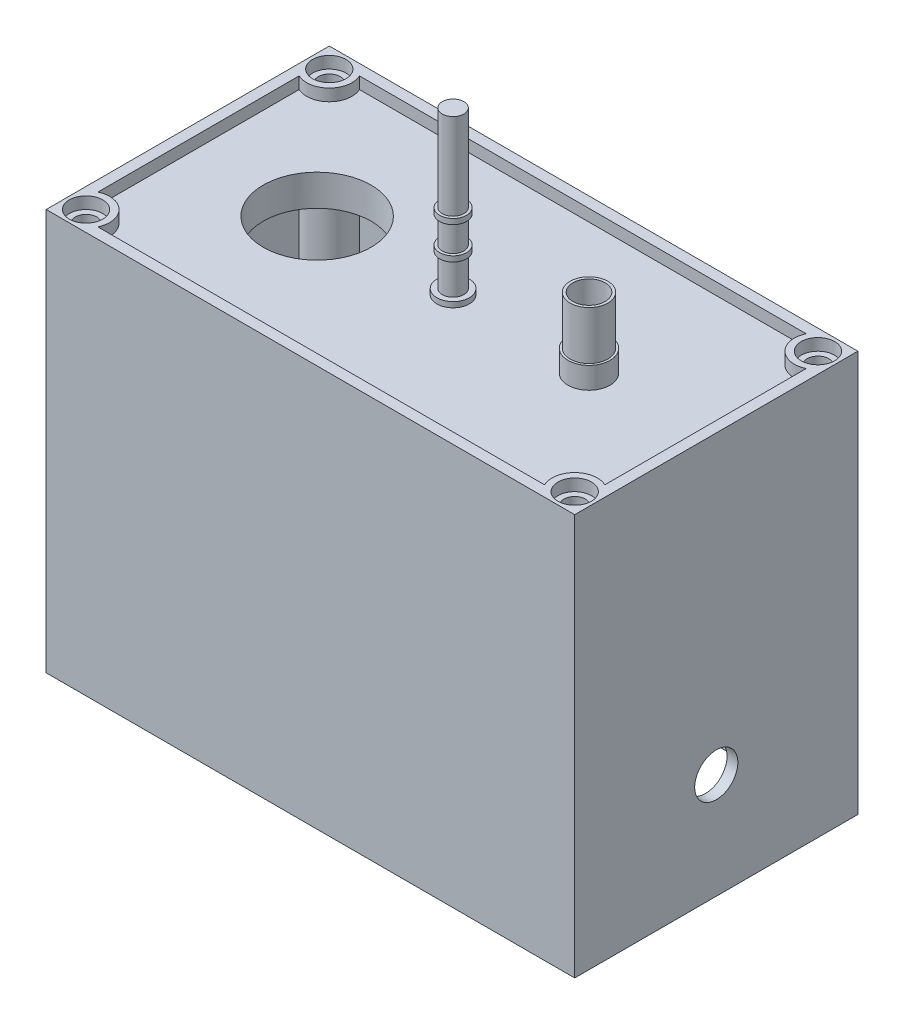
from build123d import *

# Parameters (mm, degrees)
SKETCH_1_W               = 49
SKETCH_1_H               = 26.25
EXTRUDE_1_DEPTH          = 5
SKETCH_2_R               = 1.55
CUT_EXTRUDE_1_DEPTH      = 1.1
MIRROR_2_COPY_1_SKETCH_R = 1.55
MIRROR_2_COPY_1_DEPTH    = 1.1
CUT_EXTRUDE_2_DEPTH      = 1.1
SKETCH_4_R               = 1
CUT_EXTRUDE_3_DEPTH      = 50
SKETCH_5_R               = 5
CUT_EXTRUDE_4_DEPTH      = 29.066450167
SKETCH_6_R               = 1.5
SKETCH_6_R_2             = 1
EXTRUDE_2_DEPTH          = 0.5
CUT_EXTRUDE_START        = -1
CUT_EXTRUDE_6_DEPTH      = 1
SKETCH_23_R              = 1.5
CUT_EXTRUDE_14_DEPTH     = 29.066450167
EXTRUDE_START            = 6.5
SKETCH_25_R              = 1.75
SKETCH_25_R_2            = 1.5
EXTRUDE_13_DEPTH         = 6.5
SKETCH_26_R              = 1
EXTRUDE_14_DEPTH         = 15
SKETCH_20_R              = 1.25
SKETCH_20_R_2            = 1
EXTRUDE_10_DEPTH         = 0.5
SKETCH_27_R              = 1.25
SKETCH_27_R_2            = 1
EXTRUDE_15_DEPTH         = 0.5
EXTRUDE_START_2          = 2
SKETCH_28_R              = 1.95
SKETCH_28_R_2            = 1.75
EXTRUDE_16_DEPTH         = 2
SKETCH_30_W              = 49
SKETCH_30_H              = 26.25
EXTRUDE_17_DEPTH         = 32.2
SKETCH_31_R              = 1
CUT_EXTRUDE_15_DEPTH     = 43.536521073
CUT_EXTRUDE_16_REACH     = 62.084
SKETCH_32_R              = 2


with BuildPart() as part:
    # 草图1 → 凸台-拉伸1 (new body)
    with BuildSketch(Plane(origin=(0, 0, 0), x_dir=(1, 0, 0), z_dir=(0, 1, 0))):
        Rectangle(SKETCH_1_W, SKETCH_1_H)
    extrude(amount=EXTRUDE_1_DEPTH)

    # 草图2 → 切除-拉伸1 (cut)
    with BuildSketch(Plane(origin=(0, 5, 0), x_dir=(1, 0, 0), z_dir=(0, 1, 0))):
        with Locations(Location((-22.65, 11.275, 0), (0, 0, 270))):
            Circle(SKETCH_2_R)
    cut_extrude_1 = extrude(amount=-CUT_EXTRUDE_1_DEPTH, mode=Mode.SUBTRACT)

    # 镜向1: 切除-拉伸1 across plane
    add(cut_extrude_1.mirror(Plane(origin=(0, 0, 0), x_dir=(0, 0, 1), z_dir=(1, 0, 0))), mode=Mode.SUBTRACT)

    # 镜向2: 切除-拉伸1 across plane
    add(cut_extrude_1.mirror(Plane.XY), mode=Mode.SUBTRACT)

    # 镜向2 copy 1 sketch → 镜向2 copy 1 (cut)
    with BuildSketch(Plane(origin=(0, 5, 0), x_dir=(-1, 0, 0), z_dir=(0, 1, 0))):
        with Locations(Location((-22.65, 11.275, 0), (0, 0, 270))):
            Circle(MIRROR_2_COPY_1_SKETCH_R)
    extrude(amount=-MIRROR_2_COPY_1_DEPTH, mode=Mode.SUBTRACT)

    # 草图3 → 切除-拉伸2 (cut)
    with BuildSketch(Plane(origin=(0, 5, 0), x_dir=(1, 0, 0), z_dir=(0, 1, 0))):
        with BuildLine():
            Line((-20.705283112, -12.125), (20.705283112, -12.125))
            ThreePointArc((20.705283112, -12.125), (21.120101013, -9.745101013), (23.5, -9.330283112))
            Line((23.5, -9.330283112), (23.5, 9.330283112))
            ThreePointArc((23.5, 9.330283112), (21.120101013, 9.745101013), (20.705283112, 12.125))
            Line((20.705283112, 12.125), (-20.705283112, 12.125))
            ThreePointArc((-20.705283112, 12.125), (-21.120101013, 9.745101013), (-23.5, 9.330283112))
            Line((-23.5, 9.330283112), (-23.5, -9.330283112))
            ThreePointArc((-23.5, -9.330283112), (-21.120101013, -9.745101013), (-20.705283112, -12.125))
        make_face()
    extrude(amount=-CUT_EXTRUDE_2_DEPTH, mode=Mode.SUBTRACT)

    # 草图4 → 切除-拉伸3 (cut)
    with BuildSketch(Plane(origin=(0, 3.9, 0), x_dir=(1, 0, 0), z_dir=(0, 1, 0))):
        with Locations(Location((-22.65, 11.275, 0), (0, 0, 270))):
            Circle(SKETCH_4_R)
        with Locations(Location((22.65, 11.275, 0), (0, 0, 270))):
            Circle(SKETCH_4_R)
        with Locations(Location((22.65, -11.275, 0), (0, 0, 270))):
            Circle(SKETCH_4_R)
        with Locations(Location((-22.65, -11.275, 0), (0, 0, 270))):
            Circle(SKETCH_4_R)
    cut_extrude_3 = extrude(amount=-CUT_EXTRUDE_3_DEPTH, mode=Mode.SUBTRACT)

    # 草图5 → 切除-拉伸4 (cut, through all)
    with BuildSketch(Plane(origin=(0, 3.9, 0), x_dir=(1, 0, 0), z_dir=(0, 1, 0))):
        with Locations(Location((-12.5, 0, 0), (0, 0, 270))):
            Circle(SKETCH_5_R)
    extrude(amount=-CUT_EXTRUDE_4_DEPTH, mode=Mode.SUBTRACT)

    # 草图6 → 凸台-拉伸2 (add)
    with BuildSketch(Plane(origin=(0, 3.9, 0), x_dir=(1, 0, 0), z_dir=(0, 1, 0))):
        with Locations(Location((0.1, 0, 0), (0, 0, 270))):
            Circle(SKETCH_6_R)
        with Locations(Location((0.1, 0, 0), (0, 0, 270))):
            Circle(SKETCH_6_R_2, mode=Mode.SUBTRACT)
    extrude(amount=EXTRUDE_2_DEPTH)

    # 草图10 → 切除-拉伸6 (cut)
    with BuildSketch(Plane.XZ.offset(CUT_EXTRUDE_START)):
        with BuildLine():
            Line((23.5, 9.330283112), (23.5, -9.330283112))
            ThreePointArc((23.5, -9.330283112), (21.120101013, -9.745101013), (20.705283112, -12.125))
            Line((20.705283112, -12.125), (-20.705283112, -12.125))
            ThreePointArc((-20.705283112, -12.125), (-21.120101013, -9.745101013), (-23.5, -9.330283112))
            Line((-23.5, -9.330283112), (-23.5, 9.330283112))
            ThreePointArc((-23.5, 9.330283112), (-21.120101013, 9.745101013), (-20.705283112, 12.125))
            Line((-20.705283112, 12.125), (20.705283112, 12.125))
            ThreePointArc((20.705283112, 12.125), (21.120101013, 9.745101013), (23.5, 9.330283112))
        make_face()
    extrude(amount=CUT_EXTRUDE_6_DEPTH, mode=Mode.SUBTRACT)

    # 草图23 → 切除-拉伸14 (cut, through all)
    with BuildSketch(Plane(origin=(0, 3.9, 0), x_dir=(1, 0, 0), z_dir=(0, 1, 0))):
        with Locations(Location((12.7, 0, 0), (0, 0, 270))):
            Circle(SKETCH_23_R)
    extrude(amount=-CUT_EXTRUDE_14_DEPTH, mode=Mode.SUBTRACT)

    # 草图25 → 凸台-拉伸13 (add)
    with BuildSketch(Plane(origin=(0, 3.9, 0), x_dir=(1, 0, 0), z_dir=(0, 1, 0)).offset(EXTRUDE_START)):
        with Locations(Location((12.7, 0, 0), (0, 0, 90))):
            Circle(SKETCH_25_R)
        with Locations(Location((12.7, 0, 0), (0, 0, 270))):
            Circle(SKETCH_25_R_2, mode=Mode.SUBTRACT)
    extrude(amount=-EXTRUDE_13_DEPTH)

    # 草图26 → 凸台-拉伸14 (add)
    with BuildSketch(Plane(origin=(0, 3.9, 0), x_dir=(1, 0, 0), z_dir=(0, 1, 0))):
        with Locations(Location((0.1, 0, 0), (0, 0, 90))):
            Circle(SKETCH_26_R)
    extrude(amount=EXTRUDE_14_DEPTH)

    # 草图20 → 凸台-拉伸10 (add)
    with BuildSketch(Plane(origin=(0, 10.4, 0), x_dir=(1, 0, 0), z_dir=(0, 1, 0))):
        with Locations(Location((0.1, 0, 0), (0, 0, 270))):
            Circle(SKETCH_20_R)
        with Locations(Location((0.1, 0, 0), (0, 0, 90))):
            Circle(SKETCH_20_R_2, mode=Mode.SUBTRACT)
    extrude(amount=EXTRUDE_10_DEPTH)

    # 草图27 → 凸台-拉伸15 (add)
    with BuildSketch(Plane(origin=(0, 7.4, 0), x_dir=(1, 0, 0), z_dir=(0, 1, 0))):
        with Locations(Location((0.1, 0, 0), (0, 0, 180))):
            Circle(SKETCH_27_R)
        with Locations(Location((0.1, 0, 0), (0, 0, 90))):
            Circle(SKETCH_27_R_2, mode=Mode.SUBTRACT)
    extrude(amount=EXTRUDE_15_DEPTH)

    # 草图28 → 凸台-拉伸16 (add)
    with BuildSketch(Plane(origin=(0, 3.9, 0), x_dir=(1, 0, 0), z_dir=(0, 1, 0)).offset(EXTRUDE_START_2)):
        with Locations(Location((12.7, 0, 0), (0, 0, 90))):
            Circle(SKETCH_28_R)
        with Locations(Location((12.7, 0, 0), (0, 0, 90))):
            Circle(SKETCH_28_R_2, mode=Mode.SUBTRACT)
    extrude(amount=-EXTRUDE_16_DEPTH)

    # 草图30 → 凸台-拉伸17 (add)
    with BuildSketch(Plane.XZ):
        Rectangle(SKETCH_30_W, SKETCH_30_H)
        with BuildLine():
            Line((-20.705283112, 12.125), (20.705283112, 12.125))
            ThreePointArc((20.705283112, 12.125), (21.149262885, 9.774262885), (23.5, 9.330283112))
            Line((23.5, 9.330283112), (23.5, -9.330283112))
            ThreePointArc((23.5, -9.330283112), (21.149262885, -9.774262885), (20.705283112, -12.125))
            Line((20.705283112, -12.125), (-20.705283112, -12.125))
            ThreePointArc((-20.705283112, -12.125), (-21.149262885, -9.774262885), (-23.5, -9.330283112))
            Line((-23.5, -9.330283112), (-23.5, 9.330283112))
            ThreePointArc((-23.5, 9.330283112), (-21.149262885, 9.774262885), (-20.705283112, 12.125))
        make_face(mode=Mode.SUBTRACT)
    extrude(amount=EXTRUDE_17_DEPTH)

    # 草图31 → 切除-拉伸15 (cut, through all)
    with BuildSketch(Plane(origin=(0, 0, 0), x_dir=(1, 0, 0), z_dir=(0, 1, 0))):
        with Locations(Location((22.65, 11.275, 0), (0, 0, 270))):
            Circle(SKETCH_31_R)
    extrude(amount=-CUT_EXTRUDE_15_DEPTH, mode=Mode.SUBTRACT)

    # 镜向3: 切除-拉伸3 across plane
    add(cut_extrude_3.mirror(Plane(origin=(0, 0, 0), x_dir=(0, 0, 1), z_dir=(1, 0, 0))), mode=Mode.SUBTRACT)

    # 草图32 → 切除-拉伸16 (cut, up to next)
    with BuildSketch(Plane(origin=(24.5, 0, 0), x_dir=(0, 0, -1), z_dir=(1, 0, 0)), mode=Mode.PRIVATE) as cut_extrude_16_sk1:
        with Locations((0, -22.45)):
            Circle(SKETCH_32_R)
    cut_extrude_16_tool1 = extrude(cut_extrude_16_sk1.sketch, amount=-CUT_EXTRUDE_16_REACH, mode=Mode.PRIVATE) & part.part
    add(cut_extrude_16_tool1.solids().sort_by_distance((24.5, -22.45, 0))[0], mode=Mode.SUBTRACT)


solid = part.part
